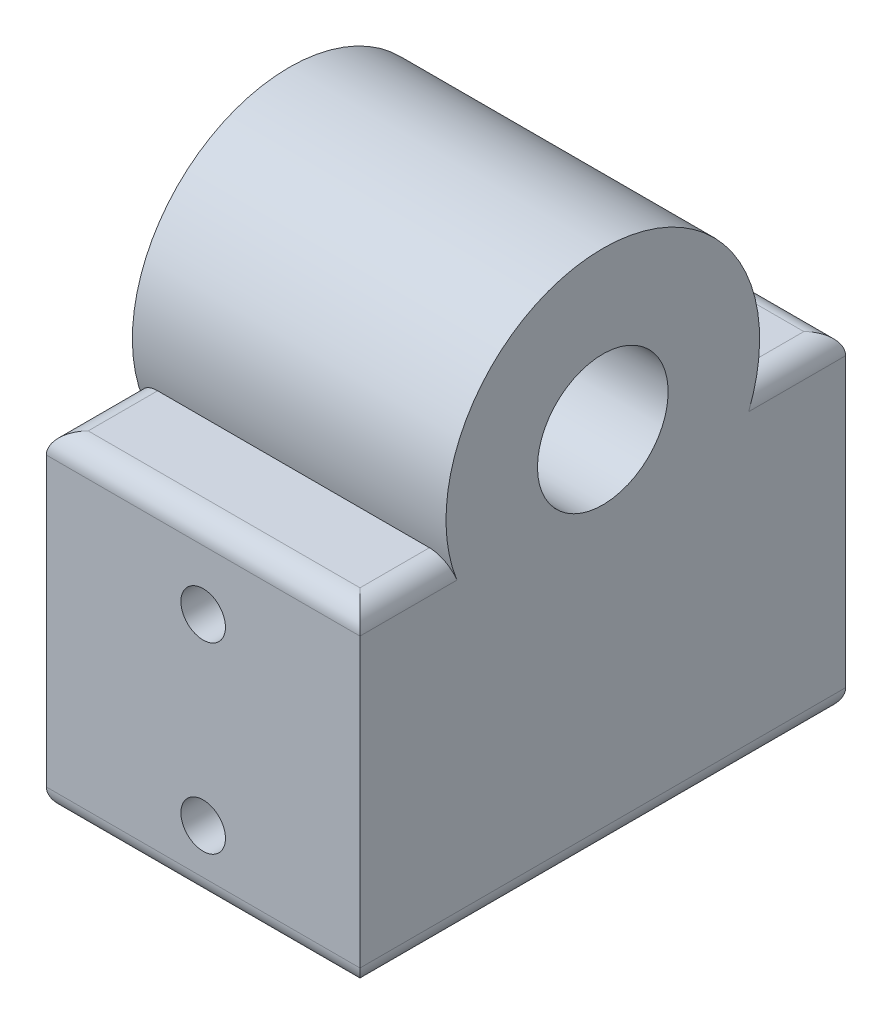
from build123d import *

# Parameters (mm, degrees)
SKETCH1_W             = 19.05
SKETCH1_H             = 29.5
BODY_DEPTH            = 31.75
SKETCH8_R             = 3.96875
AXLE_HOLE_DEPTH       = 40.856335757
F_6_32_TAPPED_HOLE1_D = 2.7051
ROUND_OVER_DEPTH      = 40.856335757
FILLET1_R             = 1.27


with BuildPart() as part:
    # Sketch1 → Body (new body)
    with BuildSketch(Plane(origin=(0, 0, 0), x_dir=(1, 0, 0), z_dir=(0, 1, 0))):
        Rectangle(SKETCH1_W, SKETCH1_H)
    extrude(amount=-BODY_DEPTH)

    # Sketch8 → Axle Hole (cut, through all)
    with BuildSketch(Plane.ZY.offset(9.525)):
        with Locations((0, -9.525)):
            Circle(SKETCH8_R)
    extrude(amount=-AXLE_HOLE_DEPTH, mode=Mode.SUBTRACT)

    # #6-32 Tapped Hole1 (through all)
    with Locations(Plane(origin=(0, -27.75, 14.75), x_dir=(1, 0, 0), z_dir=(0, 0, 1))):
        with Locations((0, 0), (0, 11.1125)):
            Hole(F_6_32_TAPPED_HOLE1_D / 2)

    # Sketch10 → Round Over (cut, through all)
    with BuildSketch(Plane(origin=(9.525, 0, 0), x_dir=(0, 0, -1), z_dir=(1, 0, 0))):
        with BuildLine():
            Line((-14.75, 0), (-14.75, -11.75))
            Line((-14.75, -11.75), (-9.261479363, -11.75))
            ThreePointArc((-9.261479363, -11.75), (-7.480599909, -3.628708793), (0, 0))
            Line((0, 0), (-14.75, 0))
        make_face()
        with BuildLine():
            Line((14.75, 0), (0, 0))
            ThreePointArc((0, 0), (6.735192091, -2.789807909), (9.525, -9.525))
            ThreePointArc((9.525, -9.525), (9.45889042, -10.645275427), (9.261479363, -11.75))
            Line((9.261479363, -11.75), (14.75, -11.75))
            Line((14.75, -11.75), (14.75, 0))
        make_face()
    extrude(amount=-ROUND_OVER_DEPTH, mode=Mode.SUBTRACT)

    # Fillet1
    fillet1_edges = [part.edges().sort_by_distance(p)[0] for p in [
        (-9.525, -31.75, 0),
        (0, -31.75, 14.75),
        (-9.525, -11.75, 12.005739682),
        (0, -11.75, 14.75),
        (9.525, -11.75, 12.005739682),
        (9.525, -31.75, 0),
        (-9.525, -11.75, -12.005739682),
        (0, -11.75, -14.75),
        (9.525, -11.75, -12.005739682),
        (0, -31.75, -14.75),
    ]]
    fillet(fillet1_edges, radius=FILLET1_R)


solid = part.part
